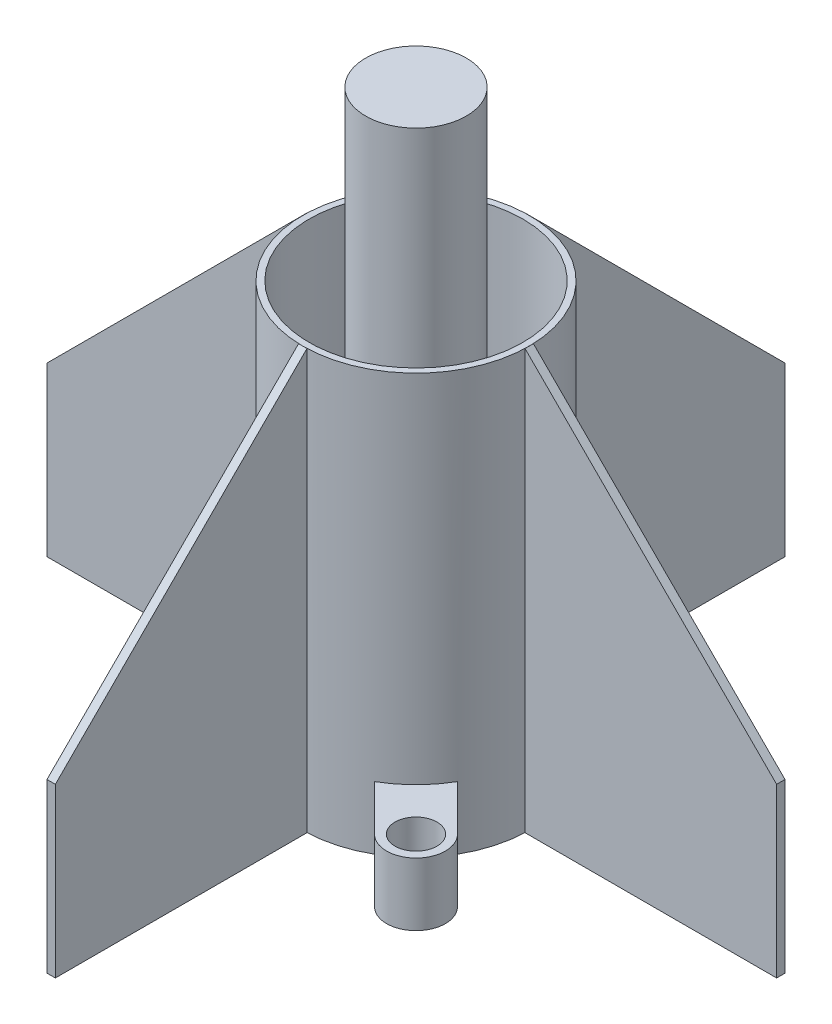
from build123d import *

# Parameters (mm, degrees)
SKETCH1_R             = 27
BOSS_EXTRUDE1_DEPTH   = 100
BOSS_EXTRUDE2_DEPTH   = 1
BOSS_EXTRUDE2_2_DEPTH = 1
BOSS_EXTRUDE3_DEPTH   = 1
BOSS_EXTRUDE3_2_DEPTH = 1
SKETCH4_R             = 25.5
CUT_EXTRUDE1_DEPTH    = 159.549676758
SKETCH9_R             = 27
BOSS_EXTRUDE6_DEPTH   = 4
SKETCH10_R            = 12
BOSS_EXTRUDE7_DEPTH   = 140
SKETCH11_R            = 10.5
CUT_EXTRUDE3_DEPTH    = 125
FILLET1_R             = 10
BOSS_EXTRUDE8_DEPTH   = 15
SKETCH14_R            = 5
CUT_EXTRUDE4_DEPTH    = 15


with BuildPart() as part:
    # Sketch1 → Boss-Extrude1 (new body)
    with BuildSketch(Plane(origin=(0, 0, 0), x_dir=(1, 0, 0), z_dir=(0, 1, 0))):
        with Locations(Location((0, 0, 0), (0, 0, 270))):
            Circle(SKETCH1_R)
    extrude(amount=BOSS_EXTRUDE1_DEPTH)

    # Sketch4 → Cut-Extrude1 (cut, through all)
    with BuildSketch(Plane(origin=(0, 0, 0), x_dir=(-1, 0, 0), z_dir=(0, -1, 0))):
        with Locations(Location((0, 0, 0), (0, 0, 90))):
            Circle(SKETCH4_R)
    extrude(amount=-CUT_EXTRUDE1_DEPTH, mode=Mode.SUBTRACT)

    # Sketch9 → Boss-Extrude6 (add)
    with BuildSketch(Plane.XZ):
        with Locations(Location((0, 0, 0), (0, 0, 90))):
            Circle(SKETCH9_R)
    extrude(amount=-BOSS_EXTRUDE6_DEPTH)

    # Sketch10 → Boss-Extrude7 (add)
    with BuildSketch(Plane.XZ):
        with Locations(Location((0, 0, 0), (0, 0, 270))):
            Circle(SKETCH10_R)
    extrude(amount=-BOSS_EXTRUDE7_DEPTH)

    # Sketch11 → Cut-Extrude3 (cut)
    with BuildSketch(Plane.XZ):
        with Locations(Location((0, 0, 0), (0, 0, 270))):
            Circle(SKETCH11_R)
    extrude(amount=-CUT_EXTRUDE3_DEPTH, mode=Mode.SUBTRACT)

    # Fillet1
    fillet1_edges = [part.edges().sort_by_distance(p)[0] for p in [
        (0, 4, 12),
    ]]
    fillet(fillet1_edges, radius=FILLET1_R)

    # Sketch13 → Boss-Extrude8 (add)
    with BuildSketch(Plane.XZ):
        with BuildLine():
            Line((13.489341446, 23.388836383), (24.33335346, 34.232848397))
            ThreePointArc((24.33335346, 34.232848397), (34.232848397, 34.232848397), (34.232848397, 24.33335346))
            Line((34.232848397, 24.33335346), (23.388836383, 13.489341446))
            Line((23.388836383, 13.489341446), (13.489341446, 23.388836383))
        make_face()
        with BuildLine():
            Line((-23.388836383, -13.489341446), (-34.232848397, -24.33335346))
            ThreePointArc((-34.232848397, -24.33335346), (-34.232848397, -34.232848397), (-24.33335346, -34.232848397))
            Line((-24.33335346, -34.232848397), (-13.489341446, -23.388836383))
            Line((-13.489341446, -23.388836383), (-23.388836383, -13.489341446))
        make_face()
    extrude(amount=-BOSS_EXTRUDE8_DEPTH)

    # Sketch14 → Cut-Extrude4 (cut)
    with BuildSketch(Plane.XZ):
        with Locations(Location((29.283100929, 29.283100929, 0), (0, 0, 270))):
            Circle(SKETCH14_R)
        with Locations(Location((-29.283100929, -29.283100929, 0), (0, 0, 90))):
            Circle(SKETCH14_R)
    extrude(amount=-CUT_EXTRUDE4_DEPTH, mode=Mode.SUBTRACT)


with BuildPart() as body_2:
    # Sketch2 → Boss-Extrude2 (new, symmetric)
    with BuildSketch(Plane.XY):
        Polygon((27, 100), (87, 40), (87, 0), (27, 0), align=None)
    extrude(amount=BOSS_EXTRUDE2_DEPTH, both=True)


with BuildPart() as body_3:
    # Sketch2 → Boss-Extrude2 2 (new, symmetric)
    with BuildSketch(Plane.XY):
        Polygon((-87, 0), (-27, 0), (-27, 100), (-87, 40), align=None)
    extrude(amount=BOSS_EXTRUDE2_2_DEPTH, both=True)


with BuildPart() as body_4:
    # Sketch3 → Boss-Extrude3 (new, symmetric)
    with BuildSketch(Plane(origin=(0, 0, 0), x_dir=(0, 0, -1), z_dir=(1, 0, 0))):
        Polygon((-27, 100), (-87, 40), (-87, 0), (-27, 0), align=None)
    extrude(amount=BOSS_EXTRUDE3_DEPTH, both=True)


with BuildPart() as body_5:
    # Sketch3 → Boss-Extrude3 2 (new, symmetric)
    with BuildSketch(Plane(origin=(0, 0, 0), x_dir=(0, 0, -1), z_dir=(1, 0, 0))):
        Polygon((27, 0), (27, 100), (87, 40), (87, 0), align=None)
    extrude(amount=BOSS_EXTRUDE3_2_DEPTH, both=True)


solid = Compound([part.part, body_2.part, body_3.part, body_4.part, body_5.part])
